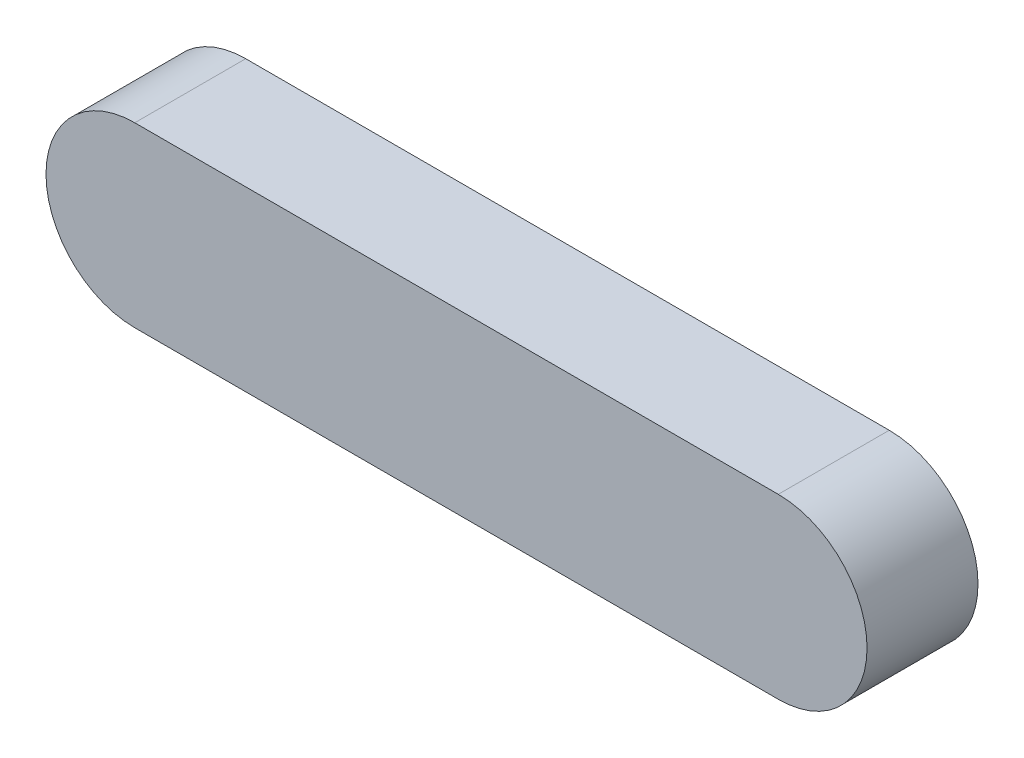
from build123d import *

# Parameters (mm, degrees)
EXTRUDE_1_DEPTH = 10


with BuildPart() as part:
    # 草图1 → 凸台-拉伸1 (new body)
    with BuildSketch(Plane.XY):
        with BuildLine():
            Line((0, 8), (58, 8))
            ThreePointArc((58, 8), (66, 0), (58, -8))
            Line((58, -8), (0, -8))
            ThreePointArc((0, -8), (-8, 0), (0, 8))
        make_face()
    extrude(amount=EXTRUDE_1_DEPTH)


solid = part.part
